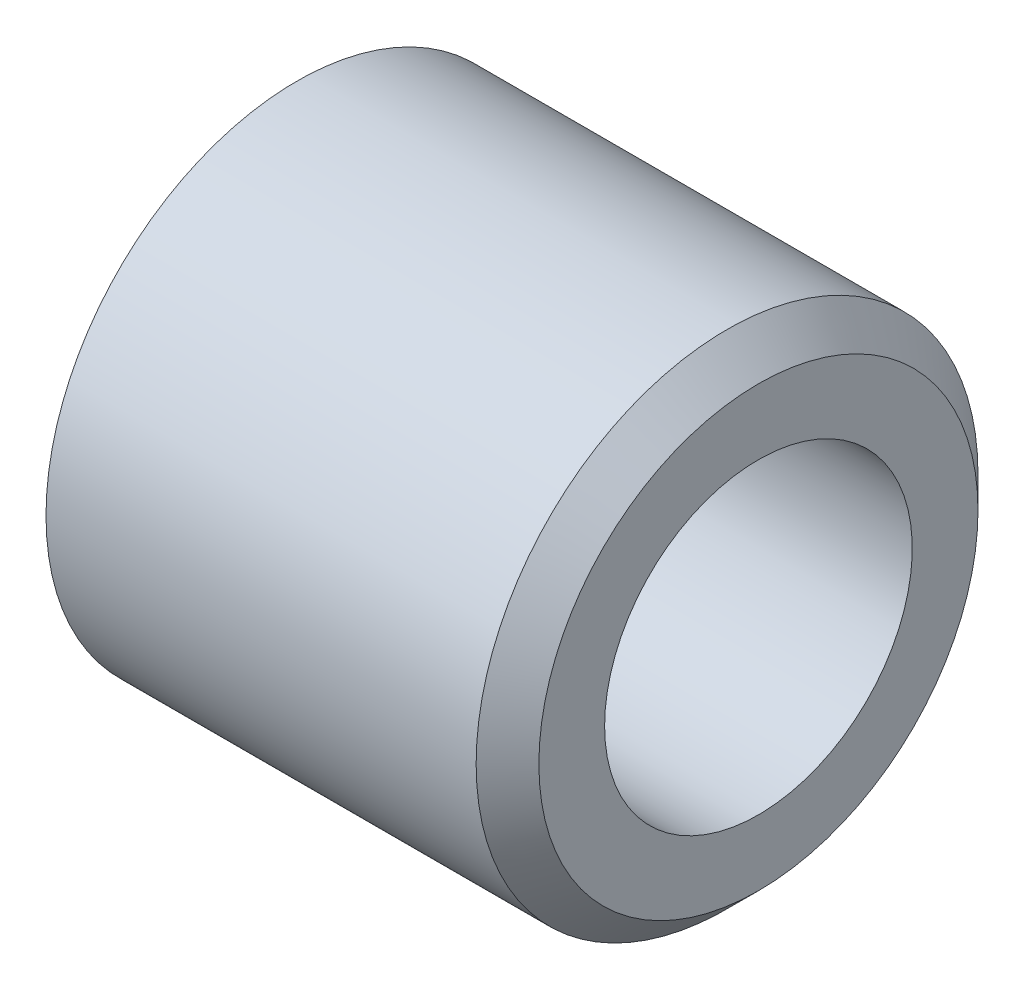
from build123d import *


with BuildPart() as part:
    # Sketch1 → BaseBody (revolve)
    with BuildSketch(Plane.XY, mode=Mode.PRIVATE) as basebody_sk:
        with BuildLine():
            Line((0, 3.9624), (0, 5.17906))
            Line((0, 5.17906), (8.8776175, 5.17906))
            Line((8.8776175, 5.17906), (9.525, 4.5316775))
            Line((9.525, 4.5316775), (9.525, 3.175))
            Line((9.525, 3.175), (0.7874, 3.175))
            ThreePointArc((0.7874, 3.175), (0.23062412, 3.40562412), (0, 3.9624))
        make_face()
    revolve(basebody_sk.sketch.rotate(Axis((0, 0, 0), (1, 0, 0)), 90), axis=Axis((0, 0, 0), (1, 0, 0)))


solid = part.part
